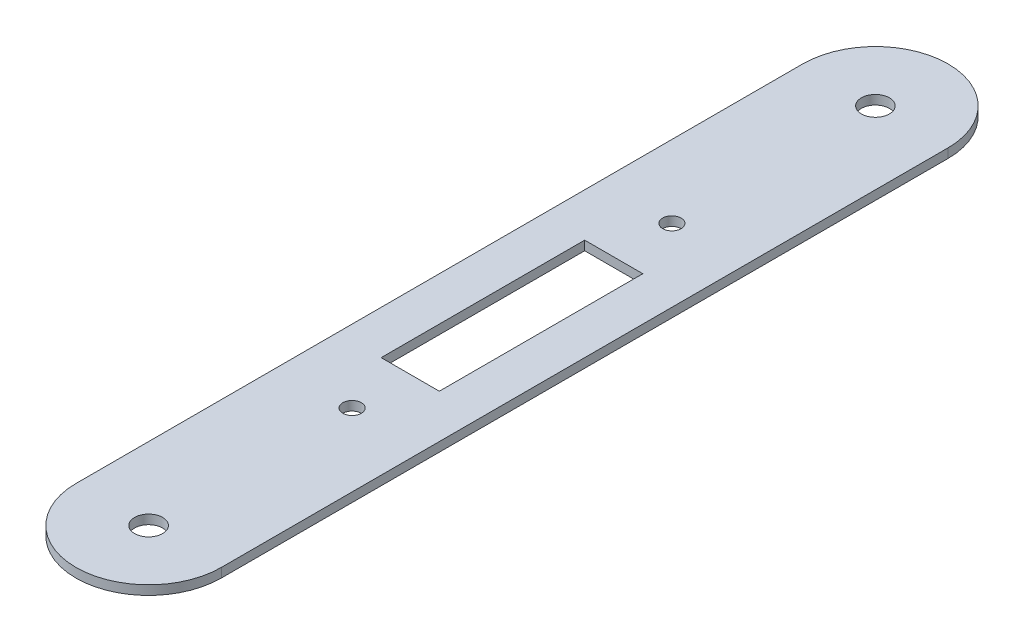
from build123d import *

# Parameters (mm, degrees)
SKETCH1_R           = 4.82
SKETCH1_R_2         = 3.175
SKETCH1_W           = 20
SKETCH1_H           = 70
BOSS_EXTRUDE1_DEPTH = 3.175


with BuildPart() as part:
    # Sketch1 → Boss-Extrude1 (new body)
    with BuildSketch(Plane(origin=(0, 0, 0), x_dir=(1, 0, 0), z_dir=(0, 1, 0))):
        with BuildLine():
            ThreePointArc((50, -25), (25, 0), (0, -25))
            Line((0, -25), (0, -274.999999959))
            ThreePointArc((0, -274.999999959), (24.999999979, -300), (50, -275))
            Line((50, -275), (50, -25))
        make_face()
        with Locations(Location((25, -25, 0), (0, 0, 270))):
            Circle(SKETCH1_R, mode=Mode.SUBTRACT)
        with Locations(Location((25, -95, 0), (0, 0, 270))):
            Circle(SKETCH1_R_2, mode=Mode.SUBTRACT)
        with Locations(Location((25, -205, 0), (0, 0, 270))):
            Circle(SKETCH1_R_2, mode=Mode.SUBTRACT)
        with Locations((25, -150)):
            Rectangle(SKETCH1_W, SKETCH1_H, mode=Mode.SUBTRACT)
        with Locations(Location((25, -275, 0), (0, 0, 270))):
            Circle(SKETCH1_R, mode=Mode.SUBTRACT)
    extrude(amount=BOSS_EXTRUDE1_DEPTH)


solid = part.part
